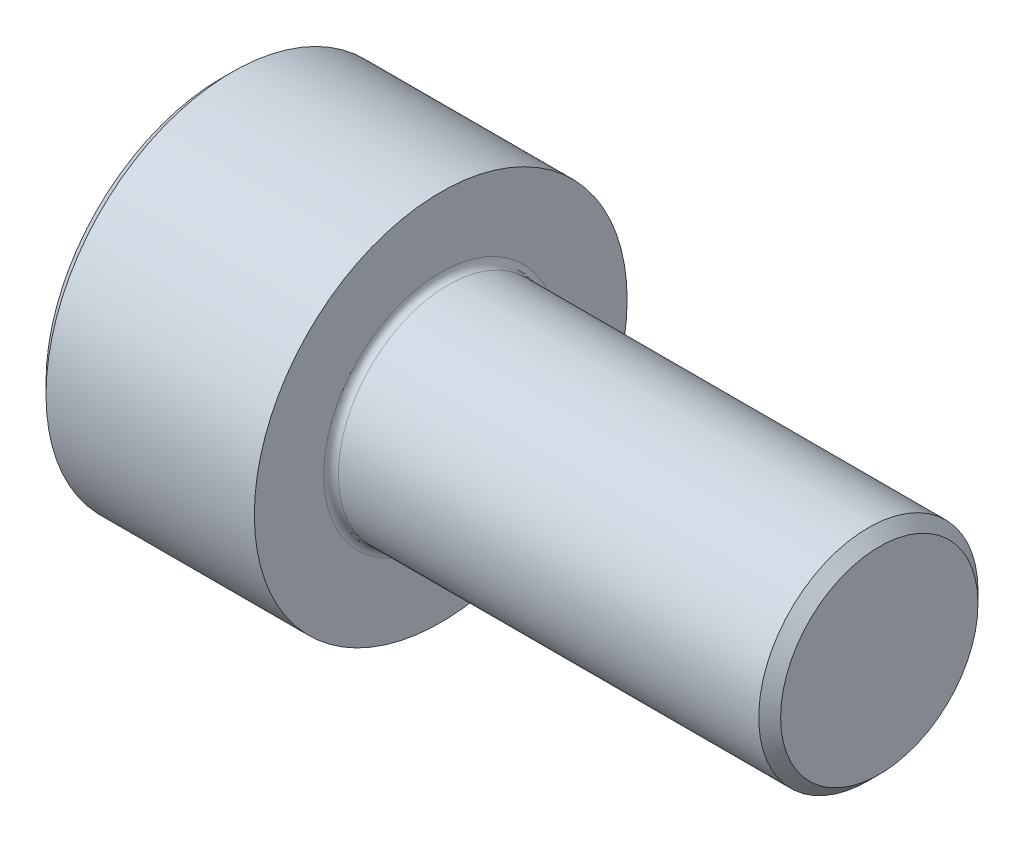
from build123d import *

# Parameters (mm, degrees)
ESBO_O1_W                = 6
ESBO_O1_H                = 5.1
ESBO_O2_R                = 3
RESSALTO_EXTRUS_O1_DEPTH = 12
CORTE_EXTRUS_O1_DEPTH    = 2.5
CHANFRO1_SIZE            = 0.3
FILETE1_R                = 0.2


with BuildPart() as part:
    # Esboço1 → Revolução1 (revolve)
    with BuildSketch(Plane(origin=(0, 0, 0), x_dir=(-1, 0, 0), z_dir=(0, 0, -1)), mode=Mode.PRIVATE) as revolu_o1_sk:
        with Locations((-3, 2.55)):
            Rectangle(ESBO_O1_W, ESBO_O1_H)
    revolve(revolu_o1_sk.sketch.rotate(Axis((6, 0, 0), (-1, 0, 0)), 270), axis=Axis((6, 0, 0), (-1, 0, 0)))

    # Esboço2 → Ressalto-extrusão1 (add)
    with BuildSketch(Plane(origin=(6, 0, 0), x_dir=(0, 0, -1), z_dir=(1, 0, 0))):
        Circle(ESBO_O2_R)
    extrude(amount=RESSALTO_EXTRUS_O1_DEPTH)

    # Esboço3 → Corte-extrusão1 (cut)
    with BuildSketch(Plane.ZY):
        Polygon((0, 2.944486373), (-2.55, 1.472243186), (-2.55, -1.472243186), (0, -2.944486373), (2.55, -1.472243186), (2.55, 1.472243186), align=None)
    extrude(amount=-CORTE_EXTRUS_O1_DEPTH, mode=Mode.SUBTRACT)

    # Esboço4 → Corte-Revolução1 (revolve, cut)
    with BuildSketch(Plane.XY, mode=Mode.PRIVATE) as corte_revolu_o1_sk:
        Polygon((2.5, 2.55), (2.5, 0), (3.972243186, 0), align=None)
    revolve(corte_revolu_o1_sk.sketch.rotate(Axis((2.5, 0, 0), (1, 0, 0)), 180), axis=Axis((2.5, 0, 0), (1, 0, 0)), mode=Mode.SUBTRACT)

    # Chanfro1
    chanfro1_edges = [part.edges().sort_by_distance(p)[0] for p in [
        (18, 0, 3),
        (0, 0, -5.1),
    ]]
    chamfer(chanfro1_edges, length=CHANFRO1_SIZE)

    # Filete1
    filete1_edges = [part.edges().sort_by_distance(p)[0] for p in [
        (6, 0, 3),
    ]]
    fillet(filete1_edges, radius=FILETE1_R)

    # Sketch1 → Cut-Revolve1 (revolve, cut)
    with BuildSketch(Plane(origin=(0, 0, 0), x_dir=(1, 0, 0), z_dir=(0, 1, 0)), mode=Mode.PRIVATE) as cut_revolve1_sk:
        Polygon((0, 2.945), (1.700296543, 0), (0, 0), align=None)
    revolve(cut_revolve1_sk.sketch.rotate(Axis((1.700296543, 0, 0), (1, 0, 0)), 180), axis=Axis((1.700296543, 0, 0), (1, 0, 0)), mode=Mode.SUBTRACT)


solid = part.part
